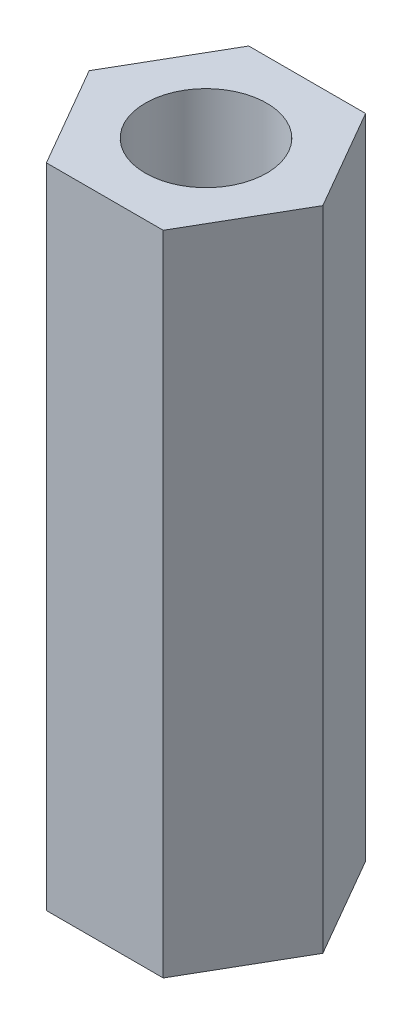
from build123d import *

# Parameters (mm, degrees)
CROQUIS1_R              = 1.5
SALIENTE_EXTRUIR1_DEPTH = 6
SKETCH_1_R              = 1.5
EXTRUDE_1_DEPTH         = 4


with BuildPart() as part:
    # Croquis1 → Saliente-Extruir1 (new, symmetric)
    with BuildSketch(Plane(origin=(0, 0, 0), x_dir=(1, 0, 0), z_dir=(0, 1, 0))):
        Polygon((1.443375673, -2.5), (2.886751346, 0), (1.443375673, 2.5), (-1.443375673, 2.5), (-2.886751346, 0), (-1.443375673, -2.5), align=None)
        with Locations(Location((0, 0, 0), (0, 0, 270))):
            Circle(CROQUIS1_R, mode=Mode.SUBTRACT)
    extrude(amount=SALIENTE_EXTRUIR1_DEPTH, both=True)

    # 草图1 → 凸台-拉伸1 (add)
    with BuildSketch(Plane(origin=(0, 6, 0), x_dir=(1, 0, 0), z_dir=(0, 1, 0))):
        Polygon((-1.443375673, -2.5), (1.443375673, -2.5), (2.886751346, 0), (1.443375673, 2.5), (-1.443375673, 2.5), (-2.886751346, 0), align=None)
        with Locations(Location((0, 0, 0), (0, 0, 270))):
            Circle(SKETCH_1_R, mode=Mode.SUBTRACT)
    extrude(amount=EXTRUDE_1_DEPTH)


solid = part.part
